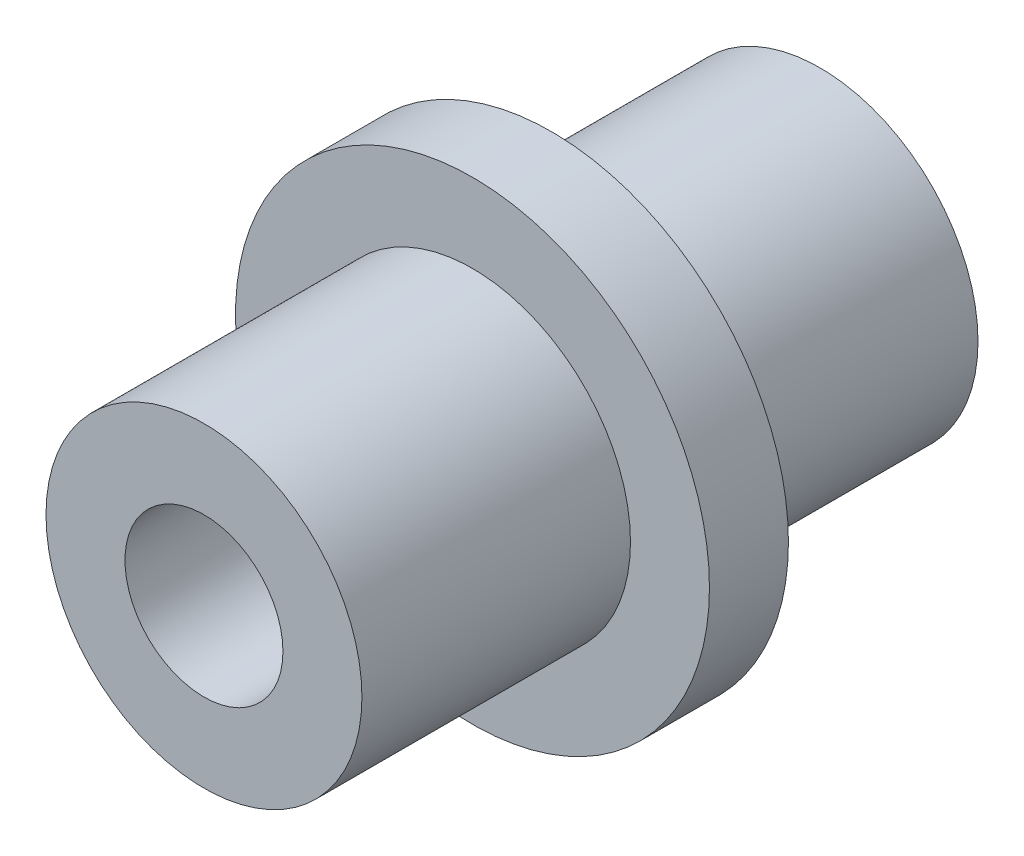
from build123d import *

# Parameters (mm, degrees)
FLANGE_SKETCH_R      = 3
FLANGE_EXTRUDE_DEPTH = 0.5
JOINT_SKETCH_R       = 2
JOINT_EXTRUDE_DEPTH  = 3.4
HOLE_SKETCH_R        = 1
HOLE_EXTRUDE_DEPTH   = 9.879189152


with BuildPart() as part:
    # Flange Sketch → Flange Extrude (new, symmetric)
    with BuildSketch(Plane.XY):
        Circle(FLANGE_SKETCH_R)
    extrude(amount=FLANGE_EXTRUDE_DEPTH, both=True)

    # Joint Sketch → Joint Extrude (add)
    with BuildSketch(Plane.XY.offset(0.5)):
        Circle(JOINT_SKETCH_R)
    joint_extrude = extrude(amount=JOINT_EXTRUDE_DEPTH)

    # Joint Mirror: Joint Extrude across plane
    add(joint_extrude.mirror(Plane.XY))

    # Hole Sketch → Hole Extrude (cut, through all)
    with BuildSketch(Plane.XY.offset(3.9)):
        Circle(HOLE_SKETCH_R)
    extrude(amount=-HOLE_EXTRUDE_DEPTH, mode=Mode.SUBTRACT)


solid = part.part
